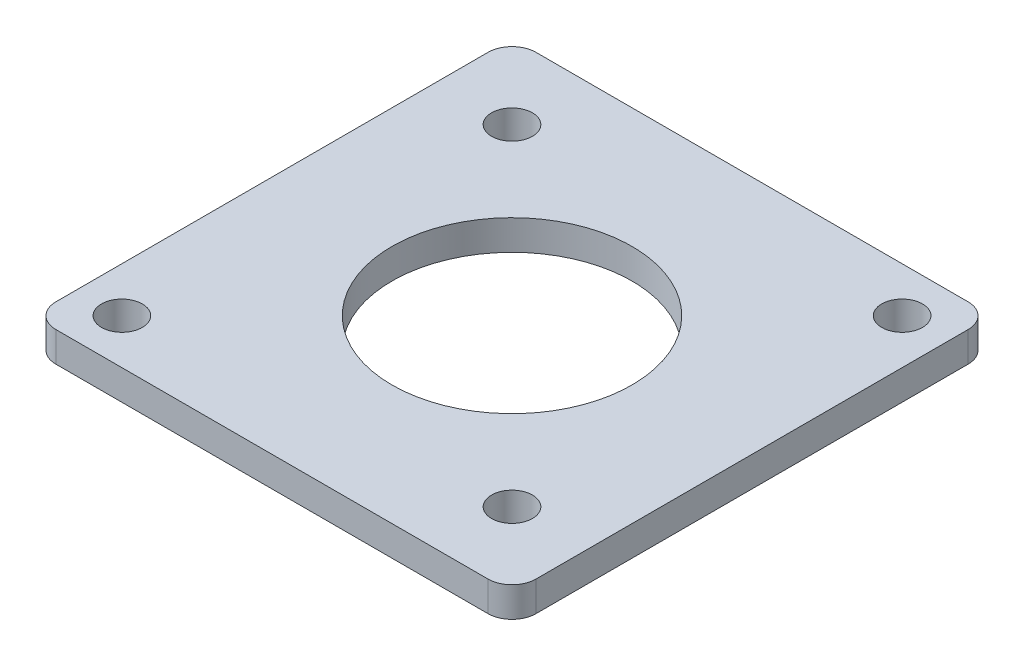
from build123d import *

# Parameters (mm, degrees)
SKETCH1_W           = 50.8
SKETCH1_H           = 50.8
SKETCH1_R           = 12.7
SKETCH1_R_2         = 2.159
BOSS_EXTRUDE1_DEPTH = 3.175
FILLET1_R           = 2.54


with BuildPart() as part:
    # Sketch1 → Boss-Extrude1 (new body)
    with BuildSketch(Plane(origin=(0, 0, 0), x_dir=(1, 0, 0), z_dir=(0, 1, 0))):
        with Locations((25.4, -25.4)):
            Rectangle(SKETCH1_W, SKETCH1_H)
        with Locations(Location((25.4, -25.4, 0), (0, 0, 270))):
            Circle(SKETCH1_R, mode=Mode.SUBTRACT)
        with Locations(Location((7.888500564, -7.888500564, 0), (0, 0, 270))):
            Circle(SKETCH1_R_2, mode=Mode.SUBTRACT)
        with Locations(Location((42.911499436, -42.911499436, 0), (0, 0, 270))):
            Circle(SKETCH1_R_2, mode=Mode.SUBTRACT)
        with Locations(Location((46.0375, -4.7625, 0), (0, 0, 270))):
            Circle(SKETCH1_R_2, mode=Mode.SUBTRACT)
        with Locations(Location((4.7625, -46.0375, 0), (0, 0, 270))):
            Circle(SKETCH1_R_2, mode=Mode.SUBTRACT)
    extrude(amount=BOSS_EXTRUDE1_DEPTH)

    # Fillet1
    fillet1_edges = [part.edges().sort_by_distance(p)[0] for p in [
        (0, 1.5875, 0),
        (50.8, 1.5875, 0),
        (50.8, 1.5875, 50.8),
        (0, 1.5875, 50.8),
    ]]
    fillet(fillet1_edges, radius=FILLET1_R)


solid = part.part
